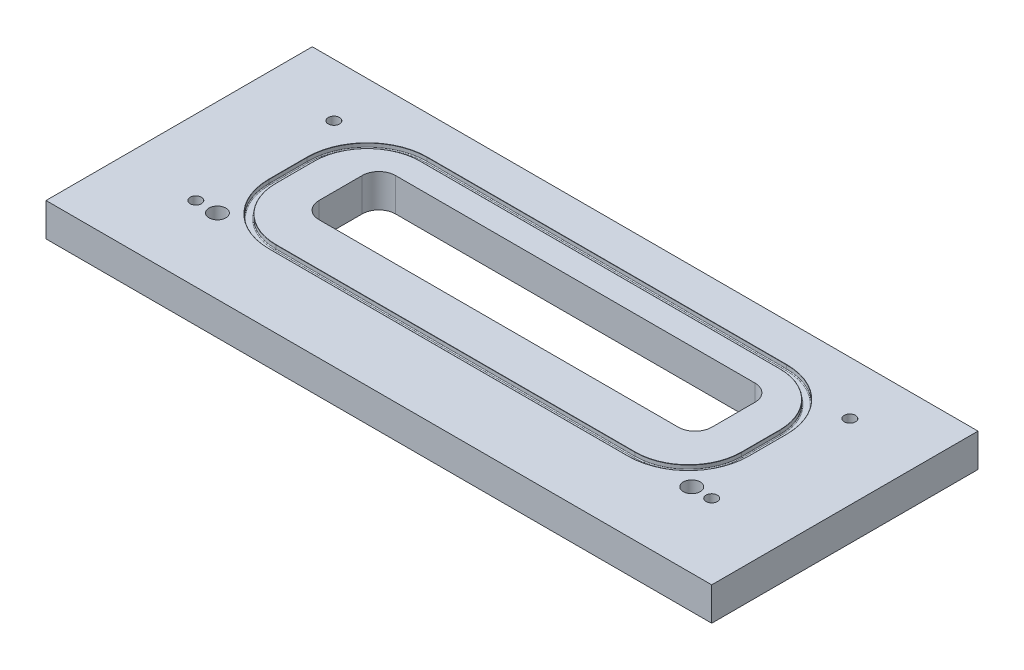
from build123d import *

# Parameters (mm, degrees)
SKETCH_1_W              = 400
SKETCH_1_H              = 160
EXTRUDE_1_DEPTH         = 10
CUT_EXTRUDE_1_DEPTH     = 2.7
FILLET_1_R              = 0.13
FILLET_2_R              = 0.5
CUT_EXTRUDE_2_DEPTH     = 432.277173057
HOLE_WIZARD_M12_1_D     = 10.2
HOLE_WIZARD_M12_1_DEPTH = 15
HOLE_WIZARD_M12_1_TIP   = 3.064389157
HOLE_WIZARD_M8_1_D      = 6.8
HOLE_WIZARD_M8_1_DEPTH  = 15
HOLE_WIZARD_M8_1_TIP    = 2.042926105


with BuildPart() as part:
    # 스케치1 → 보스-돌출1 (new, symmetric)
    with BuildSketch(Plane(origin=(0, 0, 0), x_dir=(1, 0, 0), z_dir=(0, 1, 0))):
        with Locations((200, 80)):
            Rectangle(SKETCH_1_W, SKETCH_1_H)
    extrude(amount=EXTRUDE_1_DEPTH, both=True)

    # 스케치2 → 컷-돌출1 (cut)
    with BuildSketch(Plane(origin=(0, 10, 0), x_dir=(1, 0, 0), z_dir=(0, 1, 0))):
        with BuildLine():
            Line((92, 137.05), (308, 137.05))
            ThreePointArc((308, 137.05), (333.491199462, 126.491199462), (344.05, 101))
            Line((344.05, 101), (344.05, 78))
            ThreePointArc((344.05, 78), (333.491199462, 52.508800538), (308, 41.95))
            Line((308, 41.95), (92, 41.95))
            ThreePointArc((92, 41.95), (66.508800538, 52.508800538), (55.95, 78))
            Line((55.95, 78), (55.95, 101))
            ThreePointArc((55.95, 101), (66.508800538, 126.491199462), (92, 137.05))
        make_face()
        with BuildLine():
            Line((92, 132.95), (308, 132.95))
            ThreePointArc((308, 132.95), (330.592061659, 123.592061659), (339.95, 101))
            Line((339.95, 101), (339.95, 78))
            ThreePointArc((339.95, 78), (330.592061659, 55.407938341), (308, 46.05))
            Line((308, 46.05), (92, 46.05))
            ThreePointArc((92, 46.05), (69.407938341, 55.407938341), (60.05, 78))
            Line((60.05, 78), (60.05, 101))
            ThreePointArc((60.05, 101), (69.407938341, 123.592061659), (92, 132.95))
        make_face(mode=Mode.SUBTRACT)
    extrude(amount=-CUT_EXTRUDE_1_DEPTH, mode=Mode.SUBTRACT)

    # 필렛1
    fillet_1_edges = [part.edges().sort_by_distance(p)[0] for p in [
        (66.508800538, 10, -126.491199462),
        (55.95, 10, -89.5),
        (66.508800538, 10, -52.508800538),
        (200, 10, -41.95),
        (333.491199462, 10, -52.508800538),
        (344.05, 10, -89.5),
        (333.491199462, 10, -126.491199462),
        (200, 10, -137.05),
        (69.407938341, 10, -123.592061659),
        (200, 10, -132.95),
        (330.592061659, 10, -123.592061659),
        (339.95, 10, -89.5),
        (330.592061659, 10, -55.407938341),
        (200, 10, -46.05),
        (69.407938341, 10, -55.407938341),
        (60.05, 10, -89.5),
    ]]
    fillet(fillet_1_edges, radius=FILLET_1_R)

    # 필렛2
    fillet_2_edges = [part.edges().sort_by_distance(p)[0] for p in [
        (66.508800538, 7.3, -126.491199462),
        (200, 7.3, -137.05),
        (333.491199462, 7.3, -126.491199462),
        (344.05, 7.3, -89.5),
        (333.491199462, 7.3, -52.508800538),
        (200, 7.3, -41.95),
        (66.508800538, 7.3, -52.508800538),
        (55.95, 7.3, -89.5),
        (200, 7.3, -132.95),
        (69.407938341, 7.3, -123.592061659),
        (60.05, 7.3, -89.5),
        (69.407938341, 7.3, -55.407938341),
        (200, 7.3, -46.05),
        (330.592061659, 7.3, -55.407938341),
        (339.95, 7.3, -89.5),
        (330.592061659, 7.3, -123.592061659),
    ]]
    fillet(fillet_2_edges, radius=FILLET_2_R)

    # 스케치3 → 컷-돌출2 (cut, through all)
    with BuildSketch(Plane(origin=(0, 10, 0), x_dir=(1, 0, 0), z_dir=(0, 1, 0))):
        with BuildLine():
            Line((92, 118), (308, 118))
            ThreePointArc((308, 118), (315.071067812, 115.071067812), (318, 108))
            Line((318, 108), (318, 82))
            ThreePointArc((318, 82), (315.071067812, 74.928932188), (308, 72))
            Line((308, 72), (92, 72))
            ThreePointArc((92, 72), (84.928932188, 74.928932188), (82, 82))
            Line((82, 82), (82, 108))
            ThreePointArc((82, 108), (84.928932188, 115.071067812), (92, 118))
        make_face()
    extrude(amount=-CUT_EXTRUDE_2_DEPTH, mode=Mode.SUBTRACT)

    # M12 나사 구멍1
    with Locations(Plane(origin=(0, 10, 0), x_dir=(1, 0, 0), z_dir=(0, 1, 0))):
        with Locations((58, 45), (343, 45)):
            Hole(HOLE_WIZARD_M12_1_D / 2, depth=HOLE_WIZARD_M12_1_DEPTH)
            with Locations((0, 0, -(HOLE_WIZARD_M12_1_DEPTH + HOLE_WIZARD_M12_1_TIP / 2))):  # 118° drill point
                Cone(0, HOLE_WIZARD_M12_1_D / 2, HOLE_WIZARD_M12_1_TIP, mode=Mode.SUBTRACT)

    # M8 나사 구멍1
    with Locations(Plane(origin=(0, 10, 0), x_dir=(1, 0, 0), z_dir=(0, 1, 0))):
        with Locations((45, 128), (45, 45), (355, 128), (355, 45)):
            Hole(HOLE_WIZARD_M8_1_D / 2, depth=HOLE_WIZARD_M8_1_DEPTH)
            with Locations((0, 0, -(HOLE_WIZARD_M8_1_DEPTH + HOLE_WIZARD_M8_1_TIP / 2))):  # 118° drill point
                Cone(0, HOLE_WIZARD_M8_1_D / 2, HOLE_WIZARD_M8_1_TIP, mode=Mode.SUBTRACT)


solid = part.part
